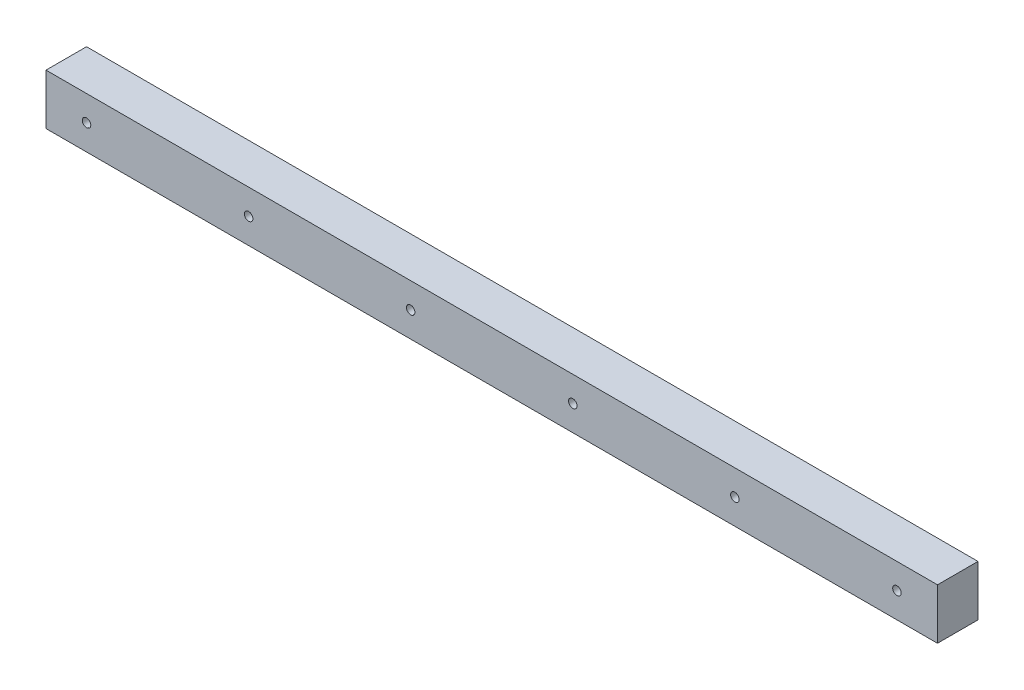
from build123d import *

# Parameters (mm, degrees)
SKETCH1_W             = 440
SKETCH1_H             = 20
BOSS_EXTRUDE1_DEPTH   = 25
M5_TAPPED_HOLE1_D     = 4.2
M5_TAPPED_HOLE1_DEPTH = 15
M5_TAPPED_HOLE1_TIP   = 1.2618073
M5_TAPPED_HOLE2_D     = 4.2
M5_TAPPED_HOLE2_DEPTH = 15
M5_TAPPED_HOLE2_TIP   = 1.2618073


with BuildPart() as part:
    # Sketch1 → Boss-Extrude1 (new body)
    with BuildSketch(Plane(origin=(0, 0, 0), x_dir=(1, 0, 0), z_dir=(0, 1, 0))):
        Rectangle(SKETCH1_W, SKETCH1_H)
    extrude(amount=BOSS_EXTRUDE1_DEPTH)

    # M5 Tapped Hole1
    with Locations(Plane(origin=(0, 0, -10), x_dir=(-1, 0, 0), z_dir=(0, 0, -1))):
        with Locations((0, 12.5), (60, 12.5), (120, 12.5), (180, 12.5), (-60, 12.5), (-120, 12.5), (-180, 12.5)):
            Hole(M5_TAPPED_HOLE1_D / 2, depth=M5_TAPPED_HOLE1_DEPTH)
            with Locations((0, 0, -(M5_TAPPED_HOLE1_DEPTH + M5_TAPPED_HOLE1_TIP / 2))):  # 118° drill point
                Cone(0, M5_TAPPED_HOLE1_D / 2, M5_TAPPED_HOLE1_TIP, mode=Mode.SUBTRACT)

    # M5 Tapped Hole2
    with Locations(Plane.XY.offset(10)):
        with Locations((40, 12.5), (120, 12.5), (200, 12.5), (-40, 12.5), (-120, 12.5), (-200, 12.5)):
            Hole(M5_TAPPED_HOLE2_D / 2, depth=M5_TAPPED_HOLE2_DEPTH)
            with Locations((0, 0, -(M5_TAPPED_HOLE2_DEPTH + M5_TAPPED_HOLE2_TIP / 2))):  # 118° drill point
                Cone(0, M5_TAPPED_HOLE2_D / 2, M5_TAPPED_HOLE2_TIP, mode=Mode.SUBTRACT)


solid = part.part
